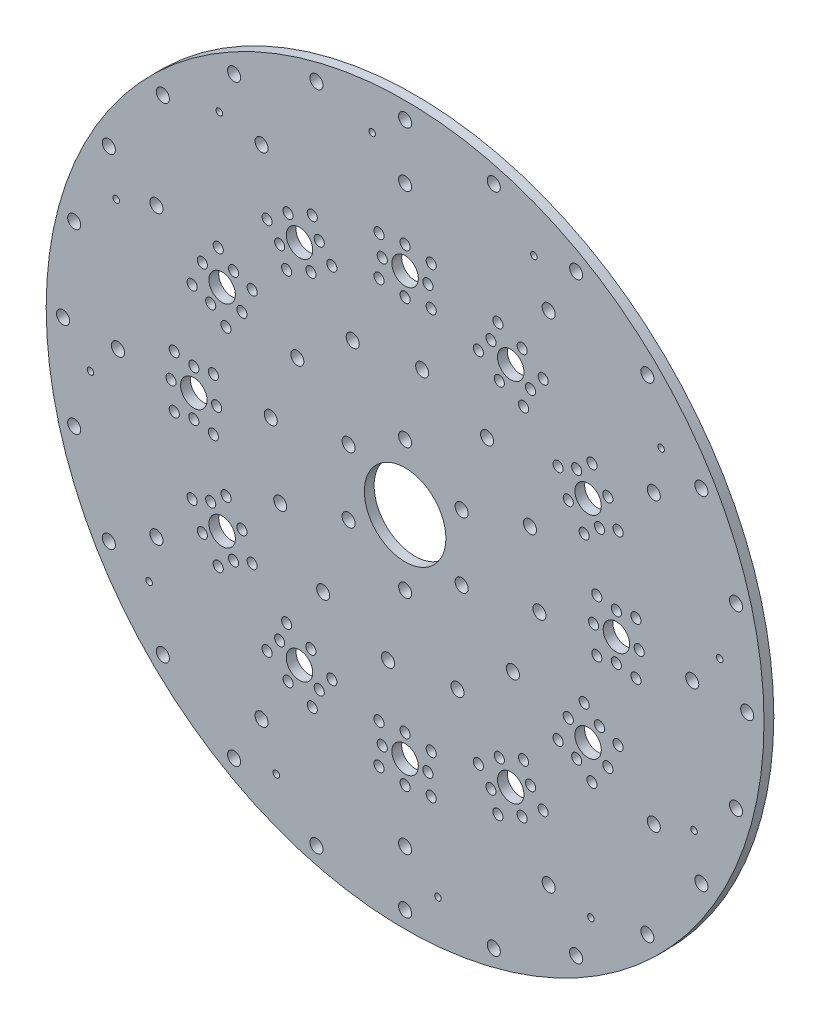
from build123d import *

# Parameters (mm, degrees)
SKETCH_1_R      = 110
SKETCH_1_R_2    = 2
SKETCH_1_R_3    = 1
SKETCH_1_R_4    = 1.55
SKETCH_1_R_5    = 4.05
SKETCH_1_R_6    = 12.5
EXTRUDE_1_DEPTH = 3


with BuildPart() as part:
    # 草图1 → 凸台-拉伸1 (new body)
    with BuildSketch(Plane.XY):
        Circle(SKETCH_1_R)
        with Locations((-74.246212025, -74.246212025)):
            Circle(SKETCH_1_R_2, mode=Mode.SUBTRACT)
        with Locations((-78.462169433, -56.93953607)):
            Circle(SKETCH_1_R_3, mode=Mode.SUBTRACT)
        with Locations((-52.42, -90.794103333)):
            Circle(SKETCH_1_R_2, mode=Mode.SUBTRACT)
        with Locations((-39.48046393, -88.542169433)):
            Circle(SKETCH_1_R_3, mode=Mode.SUBTRACT)
        with Locations((-27.175999736, -101.42221176)):
            Circle(SKETCH_1_R_2, mode=Mode.SUBTRACT)
        with Locations((-44, -76.210235533)):
            Circle(SKETCH_1_R_2, mode=Mode.SUBTRACT)
        with Locations((-42.303520778, -57.271847326)):
            Circle(SKETCH_1_R_4, mode=Mode.SUBTRACT)
        with Locations((-35.875317547, -62.13787273)):
            Circle(SKETCH_1_R_4, mode=Mode.SUBTRACT)
        with Locations((-28.447114317, -65.271847326)):
            Circle(SKETCH_1_R_4, mode=Mode.SUBTRACT)
        with Locations((-32.375317547, -56.075694903)):
            Circle(SKETCH_1_R_5, mode=Mode.SUBTRACT)
        with Locations((-8, -70.750635095)):
            Circle(SKETCH_1_R_4, mode=Mode.SUBTRACT)
        with Locations((0, -71.750635095)):
            Circle(SKETCH_1_R_4, mode=Mode.SUBTRACT)
        with Locations((-26.313139721, -59.575694903)):
            Circle(SKETCH_1_R_4, mode=Mode.SUBTRACT)
        with Locations((-7, -64.750635095)):
            Circle(SKETCH_1_R_4, mode=Mode.SUBTRACT)
        with Locations((0, -64.750635095)):
            Circle(SKETCH_1_R_5, mode=Mode.SUBTRACT)
        with Locations((-8, -58.750635095)):
            Circle(SKETCH_1_R_4, mode=Mode.SUBTRACT)
        with Locations((0, -57.750635095)):
            Circle(SKETCH_1_R_4, mode=Mode.SUBTRACT)
        with Locations((-90.794103333, -52.42)):
            Circle(SKETCH_1_R_2, mode=Mode.SUBTRACT)
        with Locations((-76.210235533, -44)):
            Circle(SKETCH_1_R_2, mode=Mode.SUBTRACT)
        with Locations((-57.271847326, -42.303520778)):
            Circle(SKETCH_1_R_4, mode=Mode.SUBTRACT)
        with Locations((-62.13787273, -35.875317547)):
            Circle(SKETCH_1_R_4, mode=Mode.SUBTRACT)
        with Locations((-65.271847326, -28.447114317)):
            Circle(SKETCH_1_R_4, mode=Mode.SUBTRACT)
        with Locations((-56.075694903, -32.375317547)):
            Circle(SKETCH_1_R_5, mode=Mode.SUBTRACT)
        with Locations((-101.42221176, -27.175999736)):
            Circle(SKETCH_1_R_2, mode=Mode.SUBTRACT)
        with Locations((-96.42, -10.08)):
            Circle(SKETCH_1_R_3, mode=Mode.SUBTRACT)
        with Locations((-104.84, 0)):
            Circle(SKETCH_1_R_2, mode=Mode.SUBTRACT)
        with Locations((-88, 0)):
            Circle(SKETCH_1_R_2, mode=Mode.SUBTRACT)
        with Locations((-59.575694903, -26.313139721)):
            Circle(SKETCH_1_R_4, mode=Mode.SUBTRACT)
        with Locations((-70.750635095, -8)):
            Circle(SKETCH_1_R_4, mode=Mode.SUBTRACT)
        with Locations((-64.750635095, -7)):
            Circle(SKETCH_1_R_4, mode=Mode.SUBTRACT)
        with Locations((-58.750635095, -8)):
            Circle(SKETCH_1_R_4, mode=Mode.SUBTRACT)
        with Locations((-38.437495374, -52.575694903)):
            Circle(SKETCH_1_R_4, mode=Mode.SUBTRACT)
        with Locations((-28.875317547, -50.013517077)):
            Circle(SKETCH_1_R_4, mode=Mode.SUBTRACT)
        with Locations((-36.303520778, -46.87954248)):
            Circle(SKETCH_1_R_4, mode=Mode.SUBTRACT)
        with Locations((-52.575694903, -38.437495374)):
            Circle(SKETCH_1_R_4, mode=Mode.SUBTRACT)
        with Locations((-46.87954248, -36.303520778)):
            Circle(SKETCH_1_R_4, mode=Mode.SUBTRACT)
        with Locations((-50.013517077, -28.875317547)):
            Circle(SKETCH_1_R_4, mode=Mode.SUBTRACT)
        with Locations((-22.447114317, -54.87954248)):
            Circle(SKETCH_1_R_4, mode=Mode.SUBTRACT)
        with Locations((-25.117277244, -33.035925654)):
            Circle(SKETCH_1_R_2, mode=Mode.SUBTRACT)
        with Locations((-5.23423734, -41.168589476)):
            Circle(SKETCH_1_R_2, mode=Mode.SUBTRACT)
        with Locations((-54.87954248, -22.447114317)):
            Circle(SKETCH_1_R_4, mode=Mode.SUBTRACT)
        with Locations((-38.270162995, -16.051312232)):
            Circle(SKETCH_1_R_2, mode=Mode.SUBTRACT)
        with Locations((0, -20)):
            Circle(SKETCH_1_R_2, mode=Mode.SUBTRACT)
        with Locations((-17.320508076, -10)):
            Circle(SKETCH_1_R_2, mode=Mode.SUBTRACT)
        with Locations((0, -104.84)):
            Circle(SKETCH_1_R_2, mode=Mode.SUBTRACT)
        with Locations((10.08, -96.42)):
            Circle(SKETCH_1_R_3, mode=Mode.SUBTRACT)
        with Locations((27.175999736, -101.42221176)):
            Circle(SKETCH_1_R_2, mode=Mode.SUBTRACT)
        with Locations((0, -88)):
            Circle(SKETCH_1_R_2, mode=Mode.SUBTRACT)
        with Locations((52.42, -90.794103333)):
            Circle(SKETCH_1_R_2, mode=Mode.SUBTRACT)
        with Locations((8, -70.750635095)):
            Circle(SKETCH_1_R_4, mode=Mode.SUBTRACT)
        with Locations((7, -64.750635095)):
            Circle(SKETCH_1_R_4, mode=Mode.SUBTRACT)
        with Locations((8, -58.750635095)):
            Circle(SKETCH_1_R_4, mode=Mode.SUBTRACT)
        with Locations((26.313139721, -59.575694903)):
            Circle(SKETCH_1_R_4, mode=Mode.SUBTRACT)
        with Locations((44, -76.210235533)):
            Circle(SKETCH_1_R_2, mode=Mode.SUBTRACT)
        with Locations((28.447114317, -65.271847326)):
            Circle(SKETCH_1_R_4, mode=Mode.SUBTRACT)
        with Locations((35.875317547, -62.13787273)):
            Circle(SKETCH_1_R_4, mode=Mode.SUBTRACT)
        with Locations((32.375317547, -56.075694903)):
            Circle(SKETCH_1_R_5, mode=Mode.SUBTRACT)
        with Locations((42.303520778, -57.271847326)):
            Circle(SKETCH_1_R_4, mode=Mode.SUBTRACT)
        with Locations((56.93953607, -78.462169433)):
            Circle(SKETCH_1_R_3, mode=Mode.SUBTRACT)
        with Locations((74.246212025, -74.246212025)):
            Circle(SKETCH_1_R_2, mode=Mode.SUBTRACT)
        with Locations((22.447114317, -54.87954248)):
            Circle(SKETCH_1_R_4, mode=Mode.SUBTRACT)
        with Locations((16.051312232, -38.270162995)):
            Circle(SKETCH_1_R_2, mode=Mode.SUBTRACT)
        with Locations((28.875317547, -50.013517077)):
            Circle(SKETCH_1_R_4, mode=Mode.SUBTRACT)
        with Locations((38.437495374, -52.575694903)):
            Circle(SKETCH_1_R_4, mode=Mode.SUBTRACT)
        with Locations((36.303520778, -46.87954248)):
            Circle(SKETCH_1_R_4, mode=Mode.SUBTRACT)
        with Locations((46.87954248, -36.303520778)):
            Circle(SKETCH_1_R_4, mode=Mode.SUBTRACT)
        with Locations((52.575694903, -38.437495374)):
            Circle(SKETCH_1_R_4, mode=Mode.SUBTRACT)
        with Locations((50.013517077, -28.875317547)):
            Circle(SKETCH_1_R_4, mode=Mode.SUBTRACT)
        with Locations((17.320508076, -10)):
            Circle(SKETCH_1_R_2, mode=Mode.SUBTRACT)
        with Locations((33.035925654, -25.117277244)):
            Circle(SKETCH_1_R_2, mode=Mode.SUBTRACT)
        with Locations((54.87954248, -22.447114317)):
            Circle(SKETCH_1_R_4, mode=Mode.SUBTRACT)
        with Locations((41.168589476, -5.23423734)):
            Circle(SKETCH_1_R_2, mode=Mode.SUBTRACT)
        with Locations((57.271847326, -42.303520778)):
            Circle(SKETCH_1_R_4, mode=Mode.SUBTRACT)
        with Locations((76.210235533, -44)):
            Circle(SKETCH_1_R_2, mode=Mode.SUBTRACT)
        with Locations((62.13787273, -35.875317547)):
            Circle(SKETCH_1_R_4, mode=Mode.SUBTRACT)
        with Locations((56.075694903, -32.375317547)):
            Circle(SKETCH_1_R_5, mode=Mode.SUBTRACT)
        with Locations((65.271847326, -28.447114317)):
            Circle(SKETCH_1_R_4, mode=Mode.SUBTRACT)
        with Locations((90.794103333, -52.42)):
            Circle(SKETCH_1_R_2, mode=Mode.SUBTRACT)
        with Locations((88.542169433, -39.48046393)):
            Circle(SKETCH_1_R_3, mode=Mode.SUBTRACT)
        with Locations((59.575694903, -26.313139721)):
            Circle(SKETCH_1_R_4, mode=Mode.SUBTRACT)
        with Locations((58.750635095, -8)):
            Circle(SKETCH_1_R_4, mode=Mode.SUBTRACT)
        with Locations((64.750635095, -7)):
            Circle(SKETCH_1_R_4, mode=Mode.SUBTRACT)
        with Locations((57.750635095, 0)):
            Circle(SKETCH_1_R_4, mode=Mode.SUBTRACT)
        with Locations((64.750635095, 0)):
            Circle(SKETCH_1_R_5, mode=Mode.SUBTRACT)
        with Locations((70.750635095, -8)):
            Circle(SKETCH_1_R_4, mode=Mode.SUBTRACT)
        with Locations((71.750635095, 0)):
            Circle(SKETCH_1_R_4, mode=Mode.SUBTRACT)
        with Locations((101.42221176, -27.175999736)):
            Circle(SKETCH_1_R_2, mode=Mode.SUBTRACT)
        with Locations((-101.42221176, 27.175999736)):
            Circle(SKETCH_1_R_2, mode=Mode.SUBTRACT)
        with Locations((-71.750635095, 0)):
            Circle(SKETCH_1_R_4, mode=Mode.SUBTRACT)
        with Locations((-70.750635095, 8)):
            Circle(SKETCH_1_R_4, mode=Mode.SUBTRACT)
        with Locations((-64.750635095, 0)):
            Circle(SKETCH_1_R_5, mode=Mode.SUBTRACT)
        with Locations((-57.750635095, 0)):
            Circle(SKETCH_1_R_4, mode=Mode.SUBTRACT)
        with Locations((-64.750635095, 7)):
            Circle(SKETCH_1_R_4, mode=Mode.SUBTRACT)
        with Locations((-58.750635095, 8)):
            Circle(SKETCH_1_R_4, mode=Mode.SUBTRACT)
        with Locations((-59.575694903, 26.313139721)):
            Circle(SKETCH_1_R_4, mode=Mode.SUBTRACT)
        with Locations((-88.542169433, 39.48046393)):
            Circle(SKETCH_1_R_3, mode=Mode.SUBTRACT)
        with Locations((-90.794103333, 52.42)):
            Circle(SKETCH_1_R_2, mode=Mode.SUBTRACT)
        with Locations((-65.271847326, 28.447114317)):
            Circle(SKETCH_1_R_4, mode=Mode.SUBTRACT)
        with Locations((-56.075694903, 32.375317547)):
            Circle(SKETCH_1_R_5, mode=Mode.SUBTRACT)
        with Locations((-62.13787273, 35.875317547)):
            Circle(SKETCH_1_R_4, mode=Mode.SUBTRACT)
        with Locations((-76.210235533, 44)):
            Circle(SKETCH_1_R_2, mode=Mode.SUBTRACT)
        with Locations((-57.271847326, 42.303520778)):
            Circle(SKETCH_1_R_4, mode=Mode.SUBTRACT)
        with Locations((-41.168589476, 5.23423734)):
            Circle(SKETCH_1_R_2, mode=Mode.SUBTRACT)
        with Locations((-54.87954248, 22.447114317)):
            Circle(SKETCH_1_R_4, mode=Mode.SUBTRACT)
        with Locations((-33.035925654, 25.117277244)):
            Circle(SKETCH_1_R_2, mode=Mode.SUBTRACT)
        with Locations((-17.320508076, 10)):
            Circle(SKETCH_1_R_2, mode=Mode.SUBTRACT)
        with Locations((-50.013517077, 28.875317547)):
            Circle(SKETCH_1_R_4, mode=Mode.SUBTRACT)
        with Locations((-52.575694903, 38.437495374)):
            Circle(SKETCH_1_R_4, mode=Mode.SUBTRACT)
        with Locations((-46.87954248, 36.303520778)):
            Circle(SKETCH_1_R_4, mode=Mode.SUBTRACT)
        with Locations((-36.303520778, 46.87954248)):
            Circle(SKETCH_1_R_4, mode=Mode.SUBTRACT)
        with Locations((-38.437495374, 52.575694903)):
            Circle(SKETCH_1_R_4, mode=Mode.SUBTRACT)
        with Locations((-28.875317547, 50.013517077)):
            Circle(SKETCH_1_R_4, mode=Mode.SUBTRACT)
        with Locations((-16.051312232, 38.270162995)):
            Circle(SKETCH_1_R_2, mode=Mode.SUBTRACT)
        with Locations((-22.447114317, 54.87954248)):
            Circle(SKETCH_1_R_4, mode=Mode.SUBTRACT)
        with Locations((-74.246212025, 74.246212025)):
            Circle(SKETCH_1_R_2, mode=Mode.SUBTRACT)
        with Locations((-56.93953607, 78.462169433)):
            Circle(SKETCH_1_R_3, mode=Mode.SUBTRACT)
        with Locations((-42.303520778, 57.271847326)):
            Circle(SKETCH_1_R_4, mode=Mode.SUBTRACT)
        with Locations((-32.375317547, 56.075694903)):
            Circle(SKETCH_1_R_5, mode=Mode.SUBTRACT)
        with Locations((-35.875317547, 62.13787273)):
            Circle(SKETCH_1_R_4, mode=Mode.SUBTRACT)
        with Locations((-28.447114317, 65.271847326)):
            Circle(SKETCH_1_R_4, mode=Mode.SUBTRACT)
        with Locations((-44, 76.210235533)):
            Circle(SKETCH_1_R_2, mode=Mode.SUBTRACT)
        with Locations((-26.313139721, 59.575694903)):
            Circle(SKETCH_1_R_4, mode=Mode.SUBTRACT)
        with Locations((-8, 58.750635095)):
            Circle(SKETCH_1_R_4, mode=Mode.SUBTRACT)
        with Locations((-7, 64.750635095)):
            Circle(SKETCH_1_R_4, mode=Mode.SUBTRACT)
        with Locations((-8, 70.750635095)):
            Circle(SKETCH_1_R_4, mode=Mode.SUBTRACT)
        with Locations((0, 71.750635095)):
            Circle(SKETCH_1_R_4, mode=Mode.SUBTRACT)
        with Locations((-52.42, 90.794103333)):
            Circle(SKETCH_1_R_2, mode=Mode.SUBTRACT)
        with Locations((-27.175999736, 101.42221176)):
            Circle(SKETCH_1_R_2, mode=Mode.SUBTRACT)
        with Locations((-10.08, 96.42)):
            Circle(SKETCH_1_R_3, mode=Mode.SUBTRACT)
        Circle(SKETCH_1_R_6, mode=Mode.SUBTRACT)
        with Locations((17.320508076, 10)):
            Circle(SKETCH_1_R_2, mode=Mode.SUBTRACT)
        with Locations((0, 20)):
            Circle(SKETCH_1_R_2, mode=Mode.SUBTRACT)
        with Locations((38.270162995, 16.051312232)):
            Circle(SKETCH_1_R_2, mode=Mode.SUBTRACT)
        with Locations((54.87954248, 22.447114317)):
            Circle(SKETCH_1_R_4, mode=Mode.SUBTRACT)
        with Locations((5.23423734, 41.168589476)):
            Circle(SKETCH_1_R_2, mode=Mode.SUBTRACT)
        with Locations((25.117277244, 33.035925654)):
            Circle(SKETCH_1_R_2, mode=Mode.SUBTRACT)
        with Locations((22.447114317, 54.87954248)):
            Circle(SKETCH_1_R_4, mode=Mode.SUBTRACT)
        with Locations((50.013517077, 28.875317547)):
            Circle(SKETCH_1_R_4, mode=Mode.SUBTRACT)
        with Locations((46.87954248, 36.303520778)):
            Circle(SKETCH_1_R_4, mode=Mode.SUBTRACT)
        with Locations((52.575694903, 38.437495374)):
            Circle(SKETCH_1_R_4, mode=Mode.SUBTRACT)
        with Locations((36.303520778, 46.87954248)):
            Circle(SKETCH_1_R_4, mode=Mode.SUBTRACT)
        with Locations((28.875317547, 50.013517077)):
            Circle(SKETCH_1_R_4, mode=Mode.SUBTRACT)
        with Locations((38.437495374, 52.575694903)):
            Circle(SKETCH_1_R_4, mode=Mode.SUBTRACT)
        with Locations((58.750635095, 8)):
            Circle(SKETCH_1_R_4, mode=Mode.SUBTRACT)
        with Locations((64.750635095, 7)):
            Circle(SKETCH_1_R_4, mode=Mode.SUBTRACT)
        with Locations((70.750635095, 8)):
            Circle(SKETCH_1_R_4, mode=Mode.SUBTRACT)
        with Locations((59.575694903, 26.313139721)):
            Circle(SKETCH_1_R_4, mode=Mode.SUBTRACT)
        with Locations((88, 0)):
            Circle(SKETCH_1_R_2, mode=Mode.SUBTRACT)
        with Locations((104.84, 0)):
            Circle(SKETCH_1_R_2, mode=Mode.SUBTRACT)
        with Locations((96.42, 10.08)):
            Circle(SKETCH_1_R_3, mode=Mode.SUBTRACT)
        with Locations((101.42221176, 27.175999736)):
            Circle(SKETCH_1_R_2, mode=Mode.SUBTRACT)
        with Locations((56.075694903, 32.375317547)):
            Circle(SKETCH_1_R_5, mode=Mode.SUBTRACT)
        with Locations((65.271847326, 28.447114317)):
            Circle(SKETCH_1_R_4, mode=Mode.SUBTRACT)
        with Locations((62.13787273, 35.875317547)):
            Circle(SKETCH_1_R_4, mode=Mode.SUBTRACT)
        with Locations((57.271847326, 42.303520778)):
            Circle(SKETCH_1_R_4, mode=Mode.SUBTRACT)
        with Locations((76.210235533, 44)):
            Circle(SKETCH_1_R_2, mode=Mode.SUBTRACT)
        with Locations((90.794103333, 52.42)):
            Circle(SKETCH_1_R_2, mode=Mode.SUBTRACT)
        with Locations((0, 57.750635095)):
            Circle(SKETCH_1_R_4, mode=Mode.SUBTRACT)
        with Locations((8, 58.750635095)):
            Circle(SKETCH_1_R_4, mode=Mode.SUBTRACT)
        with Locations((0, 64.750635095)):
            Circle(SKETCH_1_R_5, mode=Mode.SUBTRACT)
        with Locations((7, 64.750635095)):
            Circle(SKETCH_1_R_4, mode=Mode.SUBTRACT)
        with Locations((26.313139721, 59.575694903)):
            Circle(SKETCH_1_R_4, mode=Mode.SUBTRACT)
        with Locations((8, 70.750635095)):
            Circle(SKETCH_1_R_4, mode=Mode.SUBTRACT)
        with Locations((32.375317547, 56.075694903)):
            Circle(SKETCH_1_R_5, mode=Mode.SUBTRACT)
        with Locations((28.447114317, 65.271847326)):
            Circle(SKETCH_1_R_4, mode=Mode.SUBTRACT)
        with Locations((35.875317547, 62.13787273)):
            Circle(SKETCH_1_R_4, mode=Mode.SUBTRACT)
        with Locations((42.303520778, 57.271847326)):
            Circle(SKETCH_1_R_4, mode=Mode.SUBTRACT)
        with Locations((44, 76.210235533)):
            Circle(SKETCH_1_R_2, mode=Mode.SUBTRACT)
        with Locations((0, 88)):
            Circle(SKETCH_1_R_2, mode=Mode.SUBTRACT)
        with Locations((0, 104.84)):
            Circle(SKETCH_1_R_2, mode=Mode.SUBTRACT)
        with Locations((27.175999736, 101.42221176)):
            Circle(SKETCH_1_R_2, mode=Mode.SUBTRACT)
        with Locations((39.48046393, 88.542169433)):
            Circle(SKETCH_1_R_3, mode=Mode.SUBTRACT)
        with Locations((52.42, 90.794103333)):
            Circle(SKETCH_1_R_2, mode=Mode.SUBTRACT)
        with Locations((78.462169433, 56.93953607)):
            Circle(SKETCH_1_R_3, mode=Mode.SUBTRACT)
        with Locations((74.246212025, 74.246212025)):
            Circle(SKETCH_1_R_2, mode=Mode.SUBTRACT)
    extrude(amount=EXTRUDE_1_DEPTH)


solid = part.part
